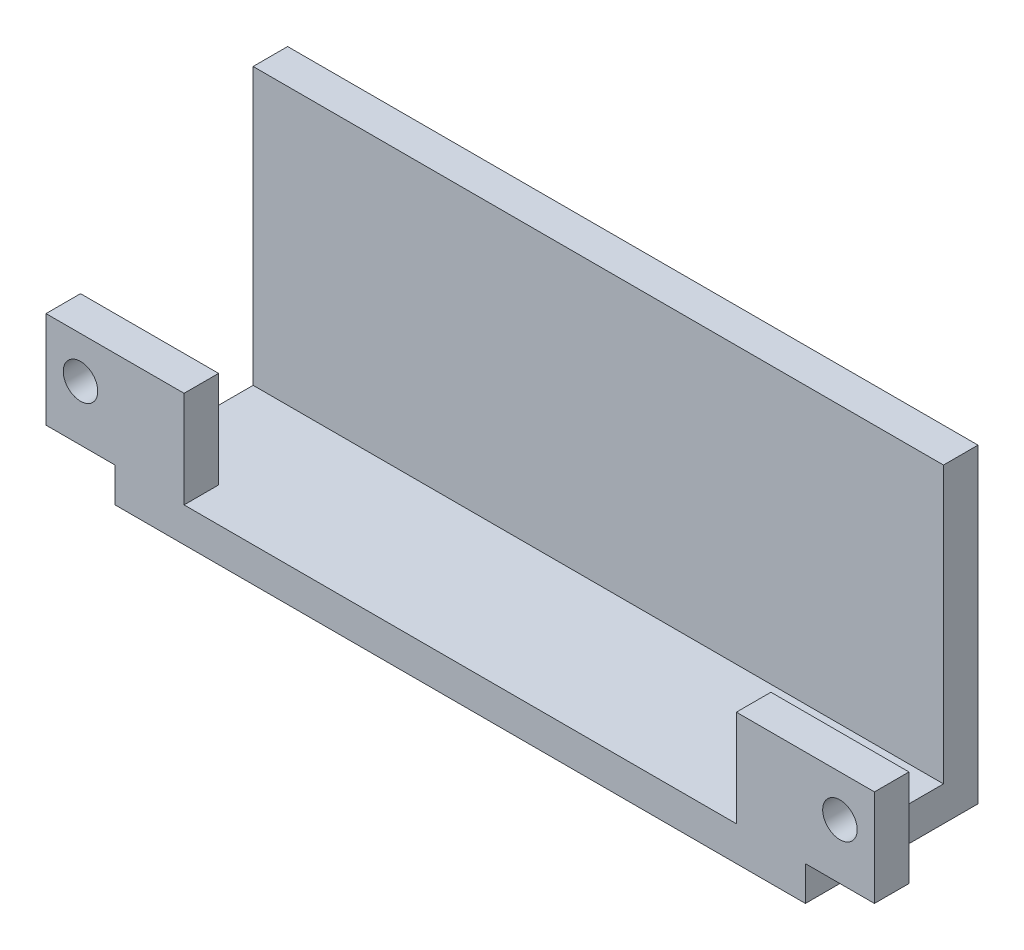
from build123d import *

# Parameters (mm, degrees)
SKETCH1_W           = 127
SKETCH1_H           = 31.75
BOSS_EXTRUDE1_DEPTH = 6.35
SKETCH2_W           = 25.4
SKETCH2_H           = 6.35
BOSS_EXTRUDE2_DEPTH = 17.78
SKETCH3_R           = 3.175
CUT_EXTRUDE1_DEPTH  = 6.35
SKETCH4_W           = 127
SKETCH4_H           = 6.35
BOSS_EXTRUDE3_DEPTH = 50.8


with BuildPart() as part:
    # Sketch1 → Boss-Extrude1 (new body)
    with BuildSketch(Plane(origin=(0, 0, 0), x_dir=(1, 0, 0), z_dir=(0, 1, 0))):
        Rectangle(SKETCH1_W, SKETCH1_H)
    extrude(amount=BOSS_EXTRUDE1_DEPTH)

    # Sketch2 → Boss-Extrude2 (add)
    with BuildSketch(Plane(origin=(0, 6.35, 0), x_dir=(1, 0, 0), z_dir=(0, 1, 0))):
        with Locations((-63.5, -12.7)):
            Rectangle(SKETCH2_W, SKETCH2_H)
        with Locations((63.5, -12.7)):
            Rectangle(SKETCH2_W, SKETCH2_H)
    extrude(amount=BOSS_EXTRUDE2_DEPTH)

    # Sketch3 → Cut-Extrude1 (cut)
    with BuildSketch(Plane(origin=(0, 0, 9.525), x_dir=(-1, 0, 0), z_dir=(0, 0, -1))):
        with Locations((69.85, 16.51)):
            Circle(SKETCH3_R)
        with Locations((-69.85, 16.51)):
            Circle(SKETCH3_R)
    extrude(amount=-CUT_EXTRUDE1_DEPTH, mode=Mode.SUBTRACT)

    # Sketch4 → Boss-Extrude3 (add)
    with BuildSketch(Plane(origin=(0, 6.35, 0), x_dir=(1, 0, 0), z_dir=(0, 1, 0))):
        with Locations((0, 12.7)):
            Rectangle(SKETCH4_W, SKETCH4_H)
    extrude(amount=BOSS_EXTRUDE3_DEPTH)


solid = part.part
